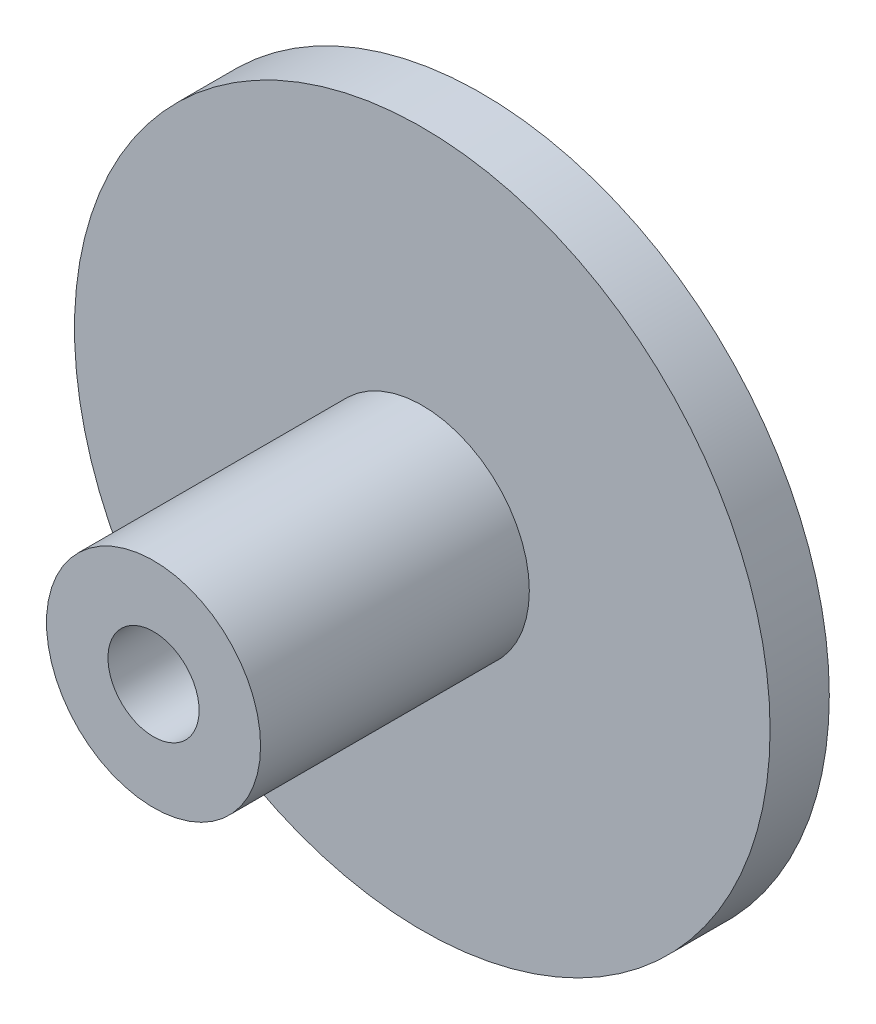
from build123d import *

# Parameters (mm, degrees)
SKETCH_1_R      = 7.635
SKETCH_1_R_2    = 1
EXTRUDE_1_DEPTH = 1.3
SKETCH_2_R      = 2.35
SKETCH_2_R_2    = 1
EXTRUDE_2_DEPTH = 5.9


with BuildPart() as part:
    # 草图1 → 凸台-拉伸1 (new body)
    with BuildSketch(Plane.XY):
        Circle(SKETCH_1_R)
        Circle(SKETCH_1_R_2, mode=Mode.SUBTRACT)
    extrude(amount=EXTRUDE_1_DEPTH)

    # 草图2 → 凸台-拉伸2 (add)
    with BuildSketch(Plane.XY.offset(1.3)):
        Circle(SKETCH_2_R)
        Circle(SKETCH_2_R_2, mode=Mode.SUBTRACT)
    extrude(amount=EXTRUDE_2_DEPTH)


solid = part.part
